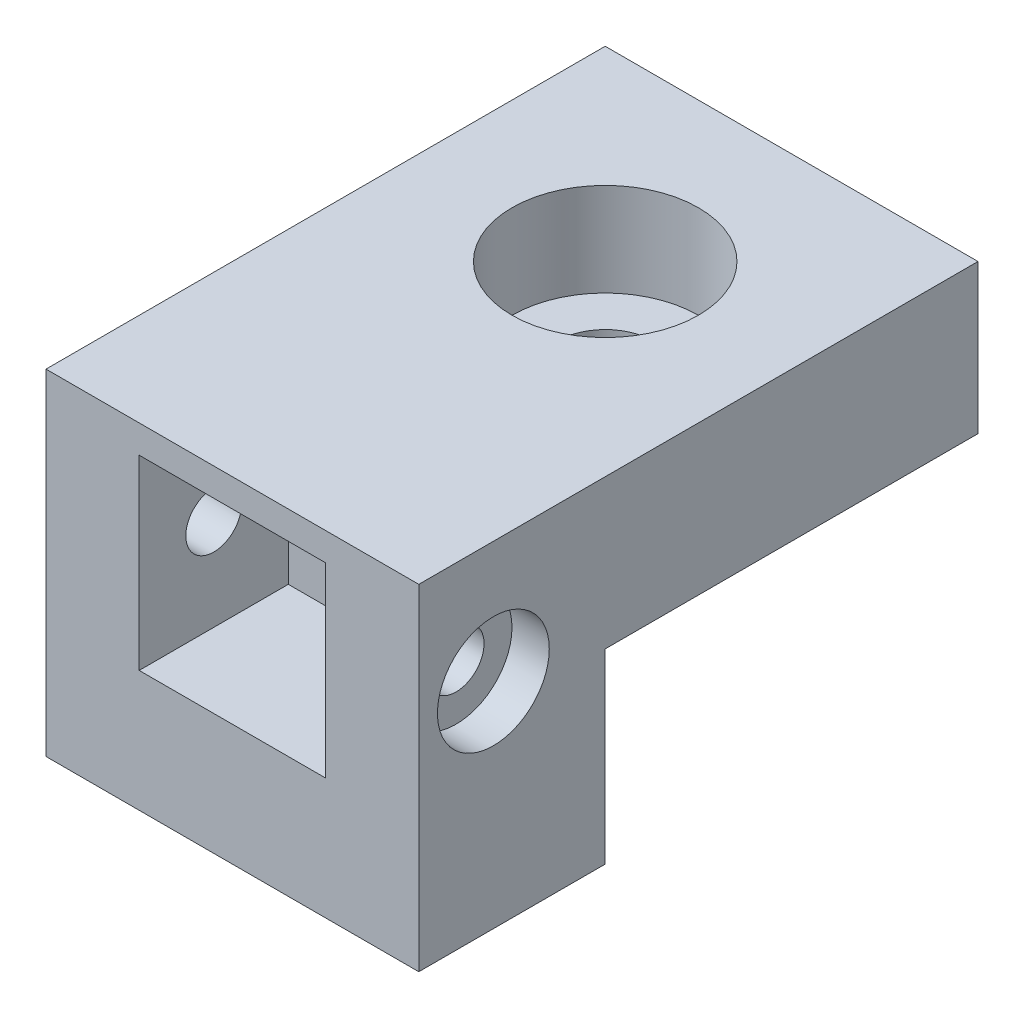
from build123d import *

# Parameters (mm, degrees)
SKETCH_1_W          = 20
SKETCH_1_H          = 20
EXTRUDE_1_DEPTH     = 8
EXTRUDE_2_DEPTH     = 20
SKETCH_3_W          = 4
SKETCH_3_H          = 13
EXTRUDE_3_DEPTH     = 20
CUT_EXTRUDE_1_DEPTH = 5
SKETCH_5_R          = 2.6
CUT_EXTRUDE_2_DEPTH = 13
EXTRUDE_4_DEPTH     = 20
SKETCH_9_W          = 20
SKETCH_9_H          = 13
SKETCH_9_W_2        = 10
SKETCH_9_H_2        = 10
EXTRUDE_5_DEPTH     = 26
SKETCH_10_W         = 10
SKETCH_10_H         = 10
CUT_EXTRUDE_3_DEPTH = 14
SKETCH_13_W         = 20
SKETCH_13_H         = 13
CUT_EXTRUDE_4_DEPTH = 20
SKETCH_14_W         = 5
SKETCH_14_H         = 5
CUT_EXTRUDE_5_DEPTH = 8
CUT_EXTRUDE_6_DEPTH = 20
SKETCH_16_R         = 3
CUT_EXTRUDE_7_DEPTH = 2
CUT_EXTRUDE_START   = -2
SKETCH_17_R         = 3
CUT_EXTRUDE_8_DEPTH = 2
SKETCH_18_W         = 20
SKETCH_18_H         = 4
CUT_EXTRUDE_9_DEPTH = 20
SKETCH_19_W         = 10
SKETCH_19_H         = 5
EXTRUDE_6_DEPTH     = 20


with BuildPart() as part:
    # 草图1 → 凸台-拉伸1 (new body)
    with BuildSketch(Plane(origin=(0, 0, 0), x_dir=(1, 0, 0), z_dir=(0, 1, 0))):
        with Locations((10, 10)):
            Rectangle(SKETCH_1_W, SKETCH_1_H)
    extrude(amount=EXTRUDE_1_DEPTH)

    # 草图2 → 凸台-拉伸2 (add)
    with BuildSketch(Plane.ZY):
        Polygon((-24, 0), (-24, -5), (-20, -5), (-20, 0), (-20, 8), (-24, 8), align=None)
    extrude(amount=-EXTRUDE_2_DEPTH)

    # 草图3 → 凸台-拉伸3 (add)
    with BuildSketch(Plane.ZY):
        with Locations((2, 1.5)):
            Rectangle(SKETCH_3_W, SKETCH_3_H)
    extrude(amount=-EXTRUDE_3_DEPTH)

    # 草图4 → 切除-拉伸1 (cut)
    with BuildSketch(Plane(origin=(0, 8, 0), x_dir=(1, 0, 0), z_dir=(0, 1, 0))):
        with BuildLine():
            ThreePointArc((15, 10), (10, 15), (5, 10))
            Line((5, 10), (15, 10))
        make_face()
        with BuildLine():
            Line((15, 10), (5, 10))
            ThreePointArc((5, 10), (10, 5), (15, 10))
        make_face()
        with BuildLine():
            ThreePointArc((15, 10), (10, 15), (5, 10))
            Line((5, 10), (15, 10))
        make_face()
        with BuildLine():
            Line((15, 10), (5, 10))
            ThreePointArc((5, 10), (10, 5), (15, 10))
        make_face()
    extrude(amount=-CUT_EXTRUDE_1_DEPTH, mode=Mode.SUBTRACT)

    # 草图5 → 切除-拉伸2 (cut)
    with BuildSketch(Plane(origin=(0, 8, 0), x_dir=(1, 0, 0), z_dir=(0, 1, 0))):
        with Locations(Location((10, 10, 0), (0, 0, 270))):
            Circle(SKETCH_5_R)
    extrude(amount=-CUT_EXTRUDE_2_DEPTH, mode=Mode.SUBTRACT)

    # 草图8 → 凸台-拉伸4 (add)
    with BuildSketch(Plane.XY.offset(4)):
        Polygon((10, 6.5), (15, 6.5), (15, 1.5), (15, -3.5), (10, -3.5), (5, -3.5), (5, 1.5), (5, 6.5), align=None)
    extrude(amount=EXTRUDE_4_DEPTH)

    # 草图9 → 凸台-拉伸5 (add)
    with BuildSketch(Plane.XY.offset(4)):
        with Locations((10, 1.5)):
            Rectangle(SKETCH_9_W, SKETCH_9_H)
        with Locations((10, 1.5)):
            Rectangle(SKETCH_9_W_2, SKETCH_9_H_2, mode=Mode.SUBTRACT)
    extrude(amount=EXTRUDE_5_DEPTH)

    # 草图10 → 切除-拉伸3 (cut)
    with BuildSketch(Plane.XY.offset(24)):
        with Locations((10, 1.5)):
            Rectangle(SKETCH_10_W, SKETCH_10_H)
    extrude(amount=-CUT_EXTRUDE_3_DEPTH, mode=Mode.SUBTRACT)

    # 草图13 → 切除-拉伸4 (cut)
    with BuildSketch(Plane.ZY):
        with Locations((20, 1.5)):
            Rectangle(SKETCH_13_W, SKETCH_13_H)
    extrude(amount=-CUT_EXTRUDE_4_DEPTH, mode=Mode.SUBTRACT)

    # 草图14 → 切除-拉伸5 (cut)
    with BuildSketch(Plane.XY.offset(10)):
        with Locations((7.5, 4)):
            Rectangle(SKETCH_14_W, SKETCH_14_H)
        with Locations((12.5, 4)):
            Rectangle(SKETCH_14_W, SKETCH_14_H)
        with Locations((7.5, -1)):
            Rectangle(SKETCH_14_W, SKETCH_14_H)
        with Locations((12.5, -1)):
            Rectangle(SKETCH_14_W, SKETCH_14_H)
    extrude(amount=-CUT_EXTRUDE_5_DEPTH, mode=Mode.SUBTRACT)

    # 草图15 → 切除-拉伸6 (cut)
    with BuildSketch(Plane.ZY):
        with BuildLine():
            ThreePointArc((4.5, 1.5), (6, 0), (7.5, 1.5))
            Line((7.5, 1.5), (4.5, 1.5))
        make_face()
        with BuildLine():
            Line((4.5, 1.5), (7.5, 1.5))
            ThreePointArc((7.5, 1.5), (6, 3), (4.5, 1.5))
        make_face()
        with BuildLine():
            ThreePointArc((4.5, 1.5), (6, 0), (7.5, 1.5))
            Line((7.5, 1.5), (4.5, 1.5))
        make_face()
        with BuildLine():
            Line((4.5, 1.5), (7.5, 1.5))
            ThreePointArc((7.5, 1.5), (6, 3), (4.5, 1.5))
        make_face()
    extrude(amount=-CUT_EXTRUDE_6_DEPTH, mode=Mode.SUBTRACT)

    # 草图16 → 切除-拉伸7 (cut)
    with BuildSketch(Plane.ZY):
        with Locations((6, 1.5)):
            Circle(SKETCH_16_R)
    extrude(amount=-CUT_EXTRUDE_7_DEPTH, mode=Mode.SUBTRACT)

    # 草图17 → 切除-拉伸8 (cut)
    with BuildSketch(Plane(origin=(20, 0, 0), x_dir=(0, 0, -1), z_dir=(1, 0, 0)).offset(CUT_EXTRUDE_START)):
        with Locations(Location((-6, 1.5, 0), (0, 0, 180))):
            Circle(SKETCH_17_R)
    extrude(amount=CUT_EXTRUDE_8_DEPTH, mode=Mode.SUBTRACT)

    # 草图18 → 切除-拉伸9 (cut)
    with BuildSketch(Plane.XZ.offset(5)):
        with Locations((10, -22)):
            Rectangle(SKETCH_18_W, SKETCH_18_H)
    extrude(amount=-CUT_EXTRUDE_9_DEPTH, mode=Mode.SUBTRACT)

    # 草图19 → 凸台-拉伸6 (add)
    with BuildSketch(Plane(origin=(20, 0, 0), x_dir=(0, 0, -1), z_dir=(1, 0, 0))):
        with Locations((-5, -7.5)):
            Rectangle(SKETCH_19_W, SKETCH_19_H)
    extrude(amount=-EXTRUDE_6_DEPTH)


solid = part.part
